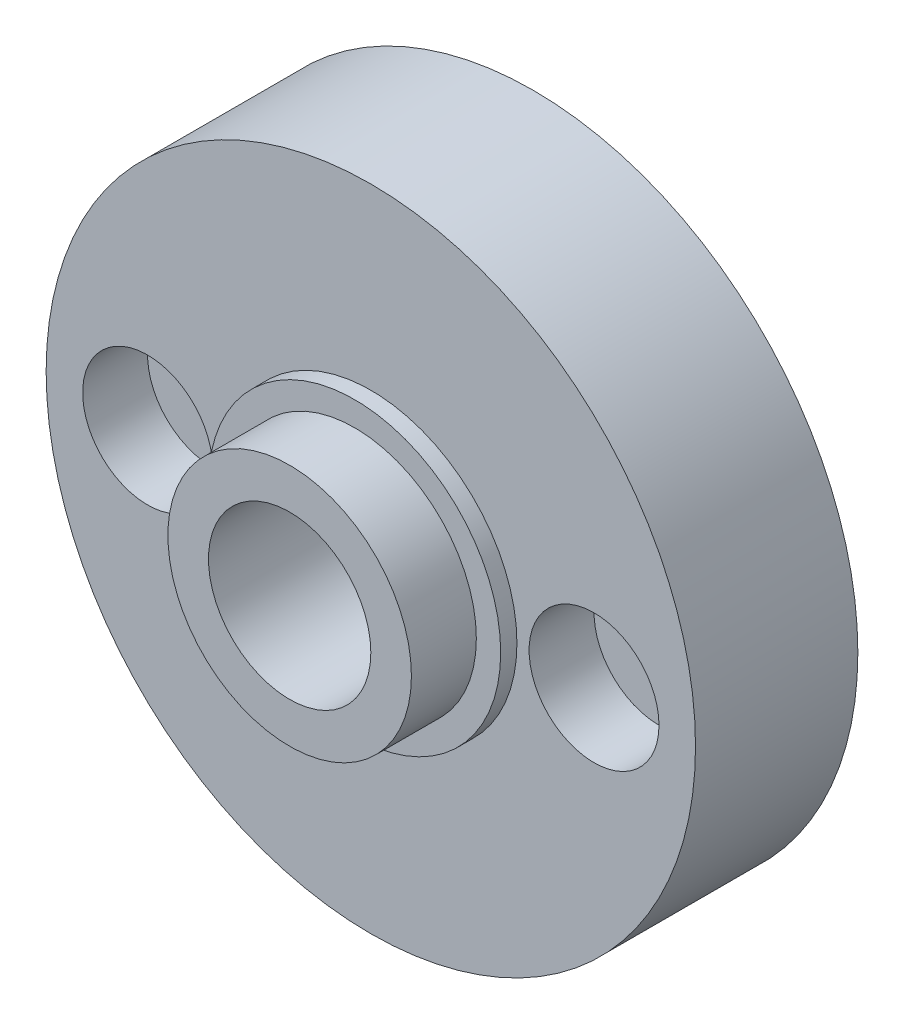
from build123d import *

# Parameters (mm, degrees)
SKETCH_1_R          = 20
SKETCH_1_R_2        = 5
SKETCH_1_R_3        = 1.65
EXTRUDE_1_DEPTH     = 10
SKETCH_2_R          = 9
SKETCH_2_R_2        = 5
EXTRUDE_2_DEPTH     = 1
SKETCH_3_R          = 7.5
SKETCH_3_R_2        = 5
EXTRUDE_3_DEPTH     = 4
SKETCH_4_R          = 4
CUT_EXTRUDE_1_DEPTH = 4


with BuildPart() as part:
    # ｽｹｯﾁ1 → ﾎﾞｽ - 押し出し1 (new body)
    with BuildSketch(Plane.XY):
        Circle(SKETCH_1_R)
        Circle(SKETCH_1_R_2, mode=Mode.SUBTRACT)
        with Locations((-13.75, 0)):
            Circle(SKETCH_1_R_3, mode=Mode.SUBTRACT)
        with Locations((13.75, 0)):
            Circle(SKETCH_1_R_3, mode=Mode.SUBTRACT)
    extrude(amount=EXTRUDE_1_DEPTH)

    # ｽｹｯﾁ2 → ﾎﾞｽ - 押し出し2 (add)
    with BuildSketch(Plane.XY.offset(10)):
        Circle(SKETCH_2_R)
        Circle(SKETCH_2_R_2, mode=Mode.SUBTRACT)
    extrude(amount=EXTRUDE_2_DEPTH)

    # ｽｹｯﾁ3 → ﾎﾞｽ - 押し出し3 (add)
    with BuildSketch(Plane.XY.offset(11)):
        Circle(SKETCH_3_R)
        Circle(SKETCH_3_R_2, mode=Mode.SUBTRACT)
    extrude(amount=EXTRUDE_3_DEPTH)

    # ｽｹｯﾁ4 → ｶｯﾄ - 押し出し1 (cut)
    with BuildSketch(Plane.XY.offset(10)):
        with Locations((-13.75, 0)):
            Circle(SKETCH_4_R)
        with Locations((13.75, 0)):
            Circle(SKETCH_4_R)
    extrude(amount=-CUT_EXTRUDE_1_DEPTH, mode=Mode.SUBTRACT)


solid = part.part
